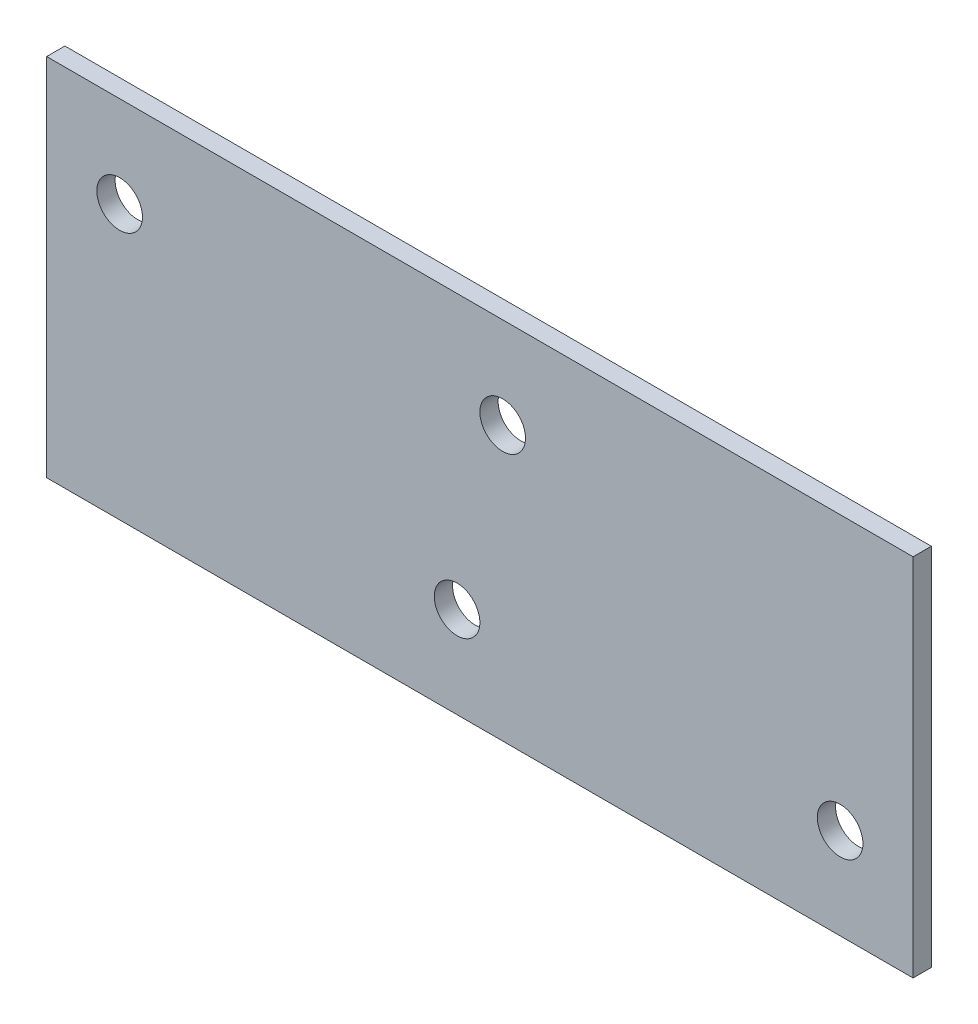
from build123d import *

# Parameters (mm, degrees)
SKETCH_1_W      = 95
SKETCH_1_H      = 40
SKETCH_1_R      = 2.5
EXTRUDE_1_DEPTH = 2


with BuildPart() as part:
    # 草图1 → 凸台-拉伸1 (new body)
    with BuildSketch(Plane.XY):
        with Locations((10, 0)):
            Rectangle(SKETCH_1_W, SKETCH_1_H)
        with Locations((-29.5, 10)):
            Circle(SKETCH_1_R, mode=Mode.SUBTRACT)
        with Locations((12.5, 10)):
            Circle(SKETCH_1_R, mode=Mode.SUBTRACT)
        with Locations((7.5, -10)):
            Circle(SKETCH_1_R, mode=Mode.SUBTRACT)
        with Locations((49.5, -10)):
            Circle(SKETCH_1_R, mode=Mode.SUBTRACT)
    extrude(amount=EXTRUDE_1_DEPTH)


solid = part.part
